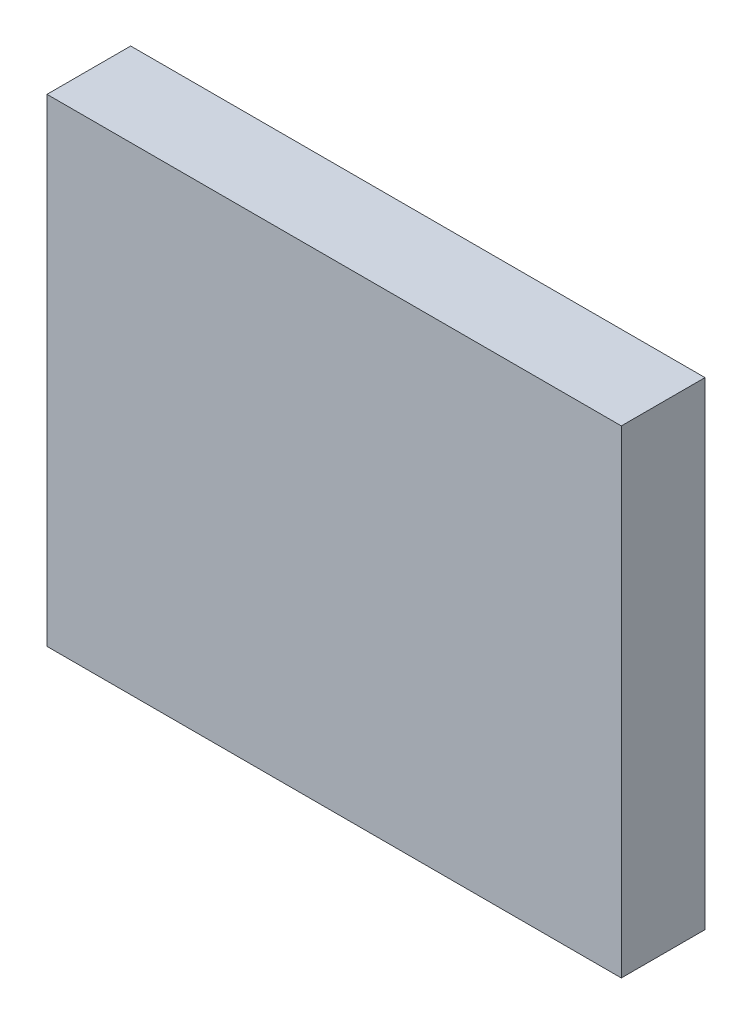
from build123d import *

# Parameters (mm, degrees)
SKETCH1_W               = 6.8635
SKETCH1_H               = 5.713972
COMPONENT_OUTLINE_DEPTH = 1


with BuildPart() as part:
    # Sketch1 → Component_Outline (new body)
    with BuildSketch(Plane.XY):
        with Locations((-0.03175, -0.106986)):
            Rectangle(SKETCH1_W, SKETCH1_H)
    extrude(amount=COMPONENT_OUTLINE_DEPTH)


solid = part.part
